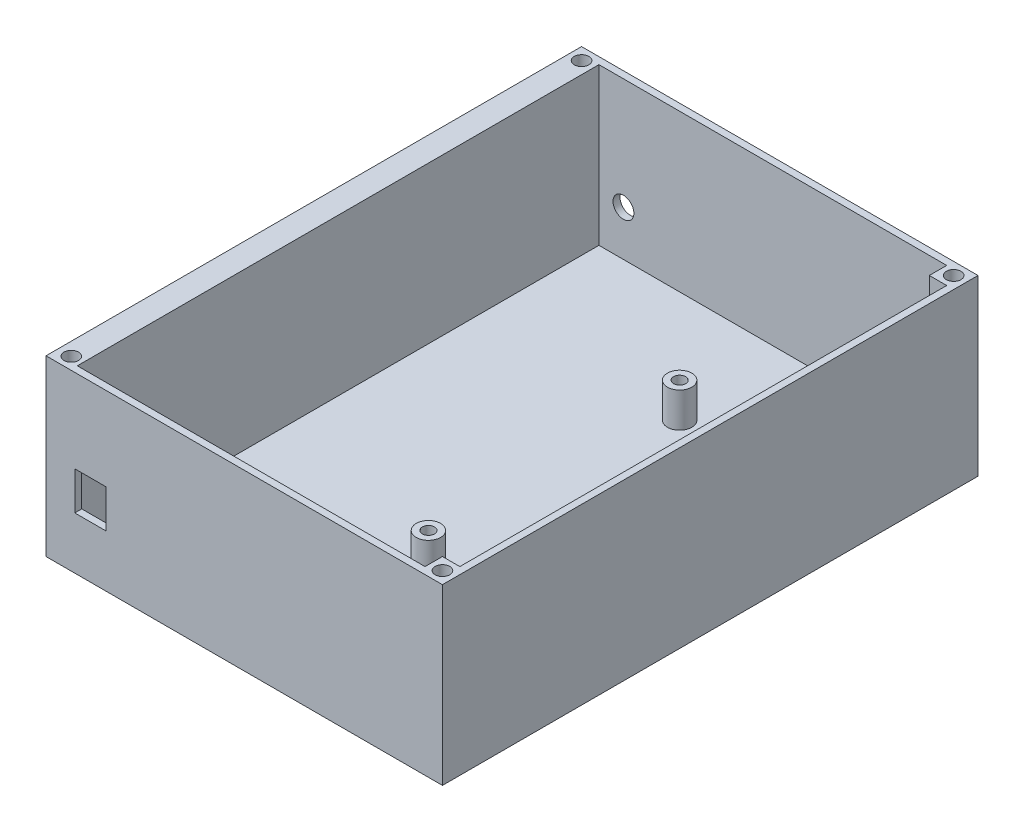
from build123d import *

# Parameters (mm, degrees)
SKETCH3_W           = 114
SKETCH3_H           = 164
BOSS_EXTRUDE2_DEPTH = 50
SKETCH4_W           = 100
SKETCH4_H           = 150
CUT_EXTRUDE2_DEPTH  = 45
SKETCH9_W           = 114
SKETCH9_H           = 5
CUT_EXTRUDE5_DEPTH  = 112.68258593
SKETCH10_W          = 114
SKETCH10_H          = 5
CUT_EXTRUDE6_DEPTH  = 112.68258593
SKETCH12_R          = 2.1
CUT_EXTRUDE8_DEPTH  = 20
SKETCH13_R          = 2.1
CUT_EXTRUDE9_DEPTH  = 20
SKETCH14_R          = 2.1
CUT_EXTRUDE10_DEPTH = 20
SKETCH15_W          = 5
SKETCH15_H          = 140
CUT_EXTRUDE11_DEPTH = 45
SKETCH16_R          = 3.5
BOSS_EXTRUDE3_DEPTH = 10
SKETCH17_R          = 1.75
CUT_EXTRUDE12_DEPTH = 8
SKETCH18_R          = 1.75
CUT_EXTRUDE13_DEPTH = 8
SKETCH19_W          = 9
SKETCH19_H          = 11
CUT_EXTRUDE14_DEPTH = 170.861708457
SKETCH21_R          = 3
CUT_EXTRUDE16_DEPTH = 170.861708457
SKETCH22_R          = 3
CUT_EXTRUDE17_DEPTH = 170.861708457


with BuildPart() as part:
    # Sketch3 → Boss-Extrude2 (new body)
    with BuildSketch(Plane(origin=(0, 0, 0), x_dir=(1, 0, 0), z_dir=(0, 1, 0))):
        Rectangle(SKETCH3_W, SKETCH3_H)
    extrude(amount=BOSS_EXTRUDE2_DEPTH)

    # Sketch4 → Cut-Extrude2 (cut)
    with BuildSketch(Plane(origin=(0, 50, 0), x_dir=(1, 0, 0), z_dir=(0, 1, 0))):
        Rectangle(SKETCH4_W, SKETCH4_H)
    extrude(amount=-CUT_EXTRUDE2_DEPTH, mode=Mode.SUBTRACT)

    # Sketch9 → Cut-Extrude5 (cut, through all)
    with BuildSketch(Plane(origin=(0, 50, 0), x_dir=(1, 0, 0), z_dir=(0, 1, 0))):
        with Locations((0, -79.5)):
            Rectangle(SKETCH9_W, SKETCH9_H)
    extrude(amount=-CUT_EXTRUDE5_DEPTH, mode=Mode.SUBTRACT)

    # Sketch10 → Cut-Extrude6 (cut, through all)
    with BuildSketch(Plane(origin=(0, 50, 0), x_dir=(1, 0, 0), z_dir=(0, 1, 0))):
        with Locations((0, 79.5)):
            Rectangle(SKETCH10_W, SKETCH10_H)
    extrude(amount=-CUT_EXTRUDE6_DEPTH, mode=Mode.SUBTRACT)

    # Sketch12 → Cut-Extrude8 (cut)
    with BuildSketch(Plane(origin=(0, 50, 0), x_dir=(1, 0, 0), z_dir=(0, 1, 0))):
        with Locations(Location((-53.236459808, -73.5, 0), (0, 0, 270))):
            Circle(SKETCH12_R)
    extrude(amount=-CUT_EXTRUDE8_DEPTH, mode=Mode.SUBTRACT)

    # Sketch13 → Cut-Extrude9 (cut)
    with BuildSketch(Plane(origin=(0, 50, 0), x_dir=(1, 0, 0), z_dir=(0, 1, 0))):
        with Locations(Location((53.5, -73.5, 0), (0, 0, 270))):
            Circle(SKETCH13_R)
    extrude(amount=-CUT_EXTRUDE9_DEPTH, mode=Mode.SUBTRACT)

    # Sketch14 → Cut-Extrude10 (cut)
    with BuildSketch(Plane(origin=(0, 50, 0), x_dir=(1, 0, 0), z_dir=(0, 1, 0))):
        with Locations(Location((53.5, 73.5, 0), (0, 0, 270))):
            Circle(SKETCH14_R)
        with Locations(Location((-53.5, 73.5, 0), (0, 0, 270))):
            Circle(SKETCH14_R)
    extrude(amount=-CUT_EXTRUDE10_DEPTH, mode=Mode.SUBTRACT)

    # Sketch15 → Cut-Extrude11 (cut)
    with BuildSketch(Plane(origin=(0, 50, 0), x_dir=(1, 0, 0), z_dir=(0, 1, 0))):
        with Locations((52.5, 0)):
            Rectangle(SKETCH15_W, SKETCH15_H)
    extrude(amount=-CUT_EXTRUDE11_DEPTH, mode=Mode.SUBTRACT)

    # Sketch16 → Boss-Extrude3 (add)
    with BuildSketch(Plane(origin=(0, 5, 0), x_dir=(1, 0, 0), z_dir=(0, 1, 0))):
        with Locations(Location((5.172888084, 43.030985647, 0), (0, 0, 90))):
            Circle(SKETCH16_R)
        with Locations(Location((6.475980518, -30.509718968, 0), (0, 0, 90))):
            Circle(SKETCH16_R)
    extrude(amount=BOSS_EXTRUDE3_DEPTH)

    # Sketch17 → Cut-Extrude12 (cut)
    with BuildSketch(Plane(origin=(0, 15, 0), x_dir=(1, 0, 0), z_dir=(0, 1, 0))):
        with Locations(Location((5.172888084, 43.030985647, 0), (0, 0, 270))):
            Circle(SKETCH17_R)
    extrude(amount=-CUT_EXTRUDE12_DEPTH, mode=Mode.SUBTRACT)

    # Sketch18 → Cut-Extrude13 (cut)
    with BuildSketch(Plane(origin=(0, 15, 0), x_dir=(1, 0, 0), z_dir=(0, 1, 0))):
        with Locations(Location((6.475980518, -30.509718968, 0), (0, 0, 270))):
            Circle(SKETCH18_R)
    extrude(amount=-CUT_EXTRUDE13_DEPTH, mode=Mode.SUBTRACT)

    # Sketch19 → Cut-Extrude14 (cut, through all)
    with BuildSketch(Plane(origin=(0, 0, 75), x_dir=(-1, 0, 0), z_dir=(0, 0, -1))):
        with Locations((44.222656572, 20.5)):
            Rectangle(SKETCH19_W, SKETCH19_H)
    extrude(amount=-CUT_EXTRUDE14_DEPTH, mode=Mode.SUBTRACT)

    # Sketch21 → Cut-Extrude16 (cut, through all)
    with BuildSketch(Plane.XY.offset(-75)):
        with Locations((42.25, 18)):
            Circle(SKETCH21_R)
    extrude(amount=-CUT_EXTRUDE16_DEPTH, mode=Mode.SUBTRACT)

    # Sketch22 → Cut-Extrude17 (cut, through all)
    with BuildSketch(Plane.XY.offset(-75)):
        with Locations((-42.95, 18)):
            Circle(SKETCH22_R)
    extrude(amount=-CUT_EXTRUDE17_DEPTH, mode=Mode.SUBTRACT)


solid = part.part
